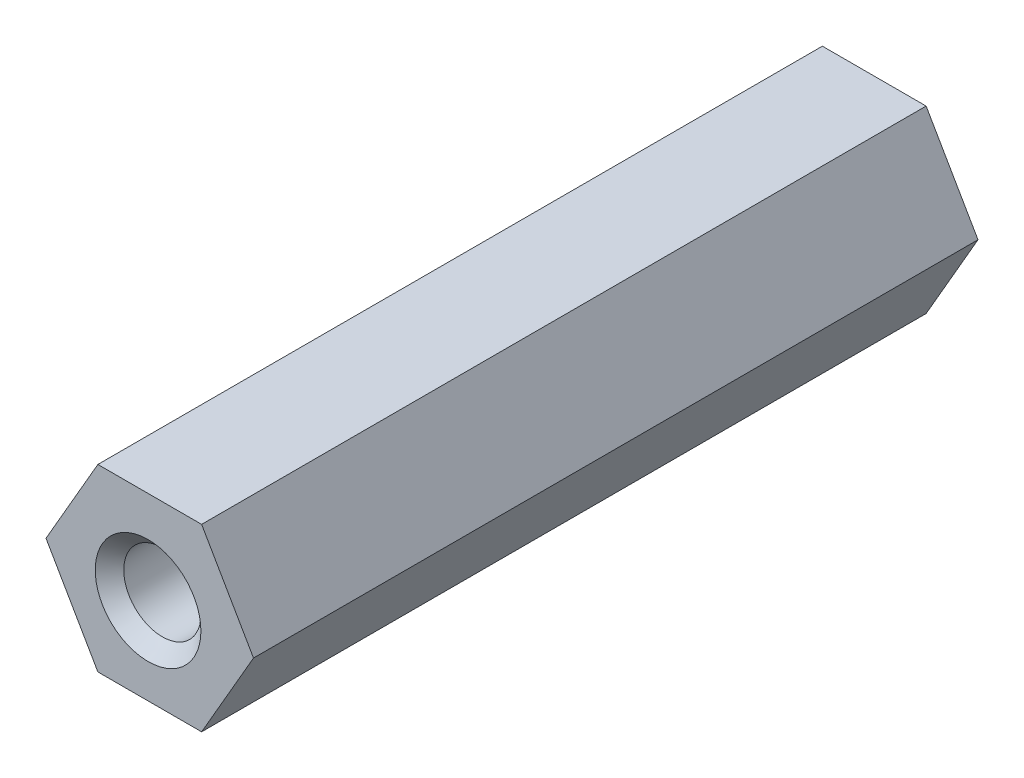
from build123d import *

# Parameters (mm, degrees)
BOSS_EXTRUDE1_DEPTH   = 12.7
F_6_32_TAPPED_HOLE8_D = 2.7051
CHAMFER1_SIZE         = 0.5
CHAMFER2_SIZE         = 0.5


with BuildPart() as part:
    # Sketch1 → Boss-Extrude1 (new, symmetric)
    with BuildSketch(Plane.XY):
        Polygon((3.637306696, 0), (1.818653348, 3.15), (-1.818653348, 3.15), (-3.637306696, 0), (-1.818653348, -3.15), (1.818653348, -3.15), align=None)
    extrude(amount=BOSS_EXTRUDE1_DEPTH, both=True)

    # #6-32 Tapped Hole8 (through all)
    with Locations(Plane(origin=(-0.058753338, -0.101763766, 12.7), x_dir=(1, 0, 0), z_dir=(0, 0, 1))):
        with Locations((0, 0)):
            Hole(F_6_32_TAPPED_HOLE8_D / 2)

    # Chamfer1
    chamfer1_edges = [part.edges().sort_by_distance(p)[0] for p in [
        (1.293796662, -0.101763766, 12.7),
    ]]
    chamfer(chamfer1_edges, length=CHAMFER1_SIZE)

    # Chamfer2
    chamfer2_edges = [part.edges().sort_by_distance(p)[0] for p in [
        (1.293796662, -0.101763766, -12.7),
    ]]
    chamfer(chamfer2_edges, length=CHAMFER2_SIZE)


solid = part.part
